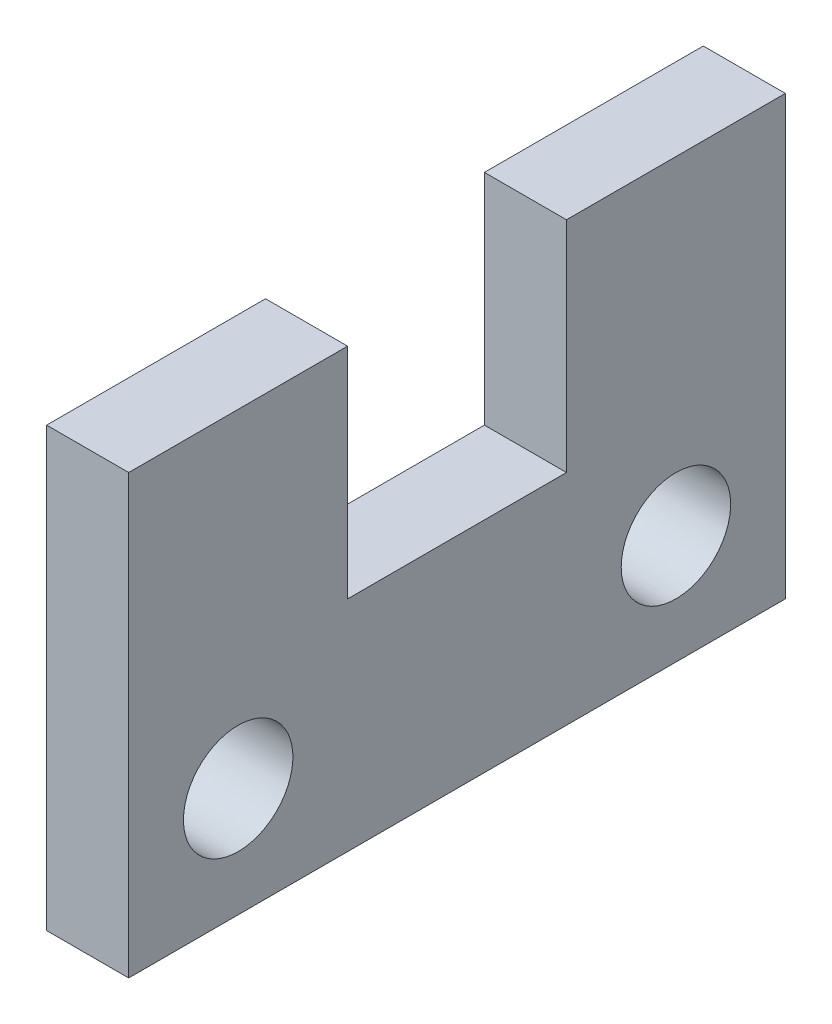
from build123d import *

# Parameters (mm, degrees)
BOSS_EXTRUDE1_DEPTH = 15
SKETCH5_R           = 10
CUT_EXTRUDE1_DEPTH  = 15


with BuildPart() as part:
    # Sketch3 → Boss-Extrude1 (new body)
    with BuildSketch(Plane(origin=(0, 0, 0), x_dir=(0, 0, -1), z_dir=(1, 0, 0))):
        Polygon((0, 0), (120, 0), (120, 80), (80, 80), (80, 40), (40, 40), (40, 80), (0, 80), align=None)
    extrude(amount=BOSS_EXTRUDE1_DEPTH)

    # Sketch5 → Cut-Extrude1 (cut)
    with BuildSketch(Plane.ZY):
        with Locations((-100, 20)):
            Circle(SKETCH5_R)
        with Locations((-20, 20)):
            Circle(SKETCH5_R)
    extrude(amount=-CUT_EXTRUDE1_DEPTH, mode=Mode.SUBTRACT)


solid = part.part
